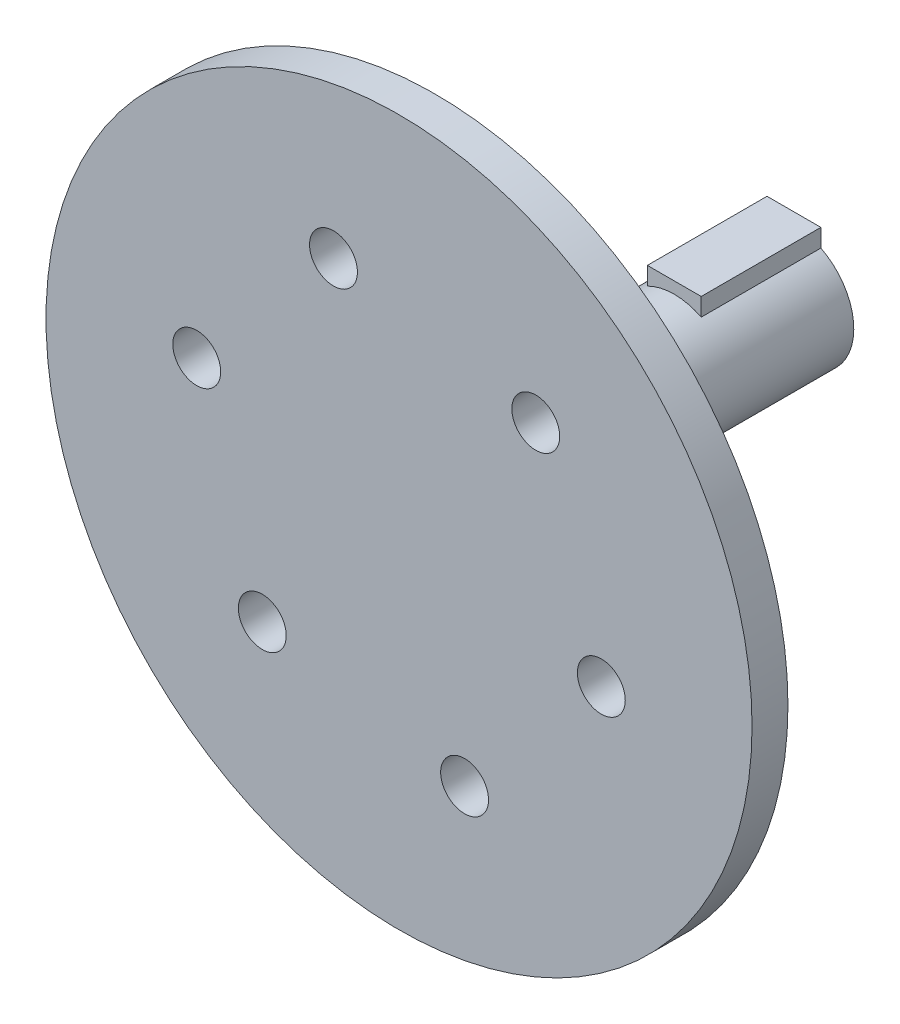
from build123d import *

# Parameters (mm, degrees)
EXTRUDE_1_DEPTH     = 10
EXTRUDE_2_DEPTH     = 30
SKETCH_3_R          = 29.5
EXTRUDE_3_DEPTH     = 3
SKETCH_4_R          = 2
CUT_EXTRUDE_1_DEPTH = 3


with BuildPart() as part:
    # 草图2 → 凸台-拉伸1 (new body)
    with BuildSketch(Plane.XY):
        with BuildLine():
            Line((2.25, 5.965142775), (-2.25, 5.965142775))
            Line((-2.25, 5.965142775), (-2.25, 4.465142775))
            ThreePointArc((-2.25, 4.465142775), (0, -5), (2.25, 4.465142775))
            Line((2.25, 4.465142775), (2.25, 5.965142775))
        make_face()
    extrude(amount=EXTRUDE_1_DEPTH)

    # 草图2<3> → 凸台-拉伸2 (add)
    with BuildSketch(Plane.XY):
        with BuildLine():
            ThreePointArc((2.25, 4.465142775), (0, 5), (-2.25, 4.465142775))
            ThreePointArc((-2.25, 4.465142775), (-2.62202212, -4.257346591), (5, 0))
            ThreePointArc((5, 0), (4.257346591, 2.62202212), (2.25, 4.465142775))
        make_face()
    extrude(amount=EXTRUDE_2_DEPTH)

    # 草图3 → 凸台-拉伸3 (add)
    with BuildSketch(Plane.XY.offset(30)):
        Circle(SKETCH_3_R)
    extrude(amount=EXTRUDE_3_DEPTH)

    # 草图4 → 切除-拉伸1 (cut)
    with BuildSketch(Plane.XY.offset(33)):
        with Locations((-5.477961715, 16.357091289)):
            Circle(SKETCH_4_R)
        with Locations((11.426675731, 12.922599651)):
            Circle(SKETCH_4_R)
        with Locations((16.904637446, -3.434491638)):
            Circle(SKETCH_4_R)
        with Locations((5.477961715, -16.357091289)):
            Circle(SKETCH_4_R)
        with Locations((-11.426675731, -12.922599651)):
            Circle(SKETCH_4_R)
        with Locations((-16.904637446, 3.434491638)):
            Circle(SKETCH_4_R)
    extrude(amount=-CUT_EXTRUDE_1_DEPTH, mode=Mode.SUBTRACT)


solid = part.part
